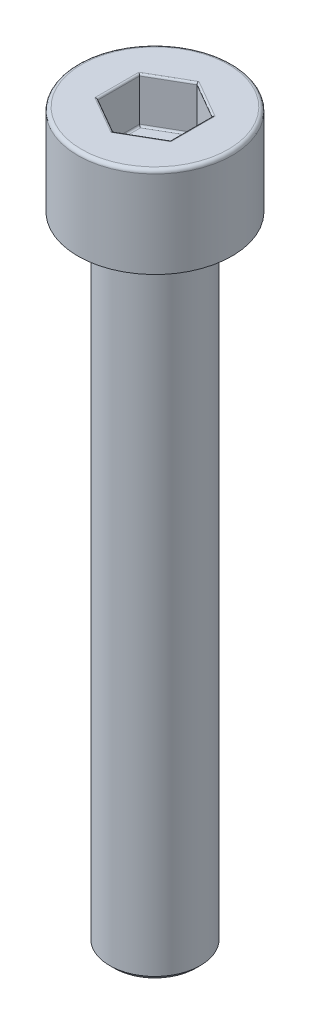
from build123d import *

# Parameters (mm, degrees)
CHAMFER1_SIZE      = 0.25
FILLET1_R          = 0.2
CUT_EXTRUDE1_DEPTH = 2.5
FILLET2_R          = 0.1


with BuildPart() as part:
    # Sketch1 → Revolve1 (revolve)
    with BuildSketch(Plane.XY, mode=Mode.PRIVATE) as revolve1_sk:
        Polygon((0, -40), (-2.5, -40), (-2.5, -5), (-4.25, -5), (-4.25, 0), (0, 0), align=None)
    revolve(revolve1_sk.sketch.rotate(Axis((0, 0, 0), (0, -1, 0)), 270), axis=Axis((0, 0, 0), (0, -1, 0)))

    # Chamfer1
    chamfer1_edges = [part.edges().sort_by_distance(p)[0] for p in [
        (0, -5, -2.5),
        (0, -40, -2.5),
    ]]
    chamfer(chamfer1_edges, length=CHAMFER1_SIZE)

    # Fillet1
    fillet1_edges = [part.edges().sort_by_distance(p)[0] for p in [
        (0, 0, -4.25),
    ]]
    fillet(fillet1_edges, radius=FILLET1_R)

    # Sketch2 → Cut-Extrude1 (cut)
    with BuildSketch(Plane(origin=(0, 0, 0), x_dir=(1, 0, 0), z_dir=(0, 1, 0))):
        Polygon((0, 2.309401077), (-2, 1.154700538), (-2, -1.154700538), (0, -2.309401077), (2, -1.154700538), (2, 1.154700538), align=None)
    extrude(amount=-CUT_EXTRUDE1_DEPTH, mode=Mode.SUBTRACT)

    # Fillet2
    fillet2_edges = [part.edges().sort_by_distance(p)[0] for p in [
        (1, -2.5, -1.732050808),
        (2, -2.5, 0),
        (1, -2.5, 1.732050808),
        (-1, -2.5, 1.732050808),
        (-2, -2.5, 0),
        (-1, -2.5, -1.732050808),
        (1, 0, -1.732050808),
        (-1, 0, -1.732050808),
        (-2, 0, 0),
        (-1, 0, 1.732050808),
        (1, 0, 1.732050808),
        (2, 0, 0),
    ]]
    fillet(fillet2_edges, radius=FILLET2_R)


solid = part.part
